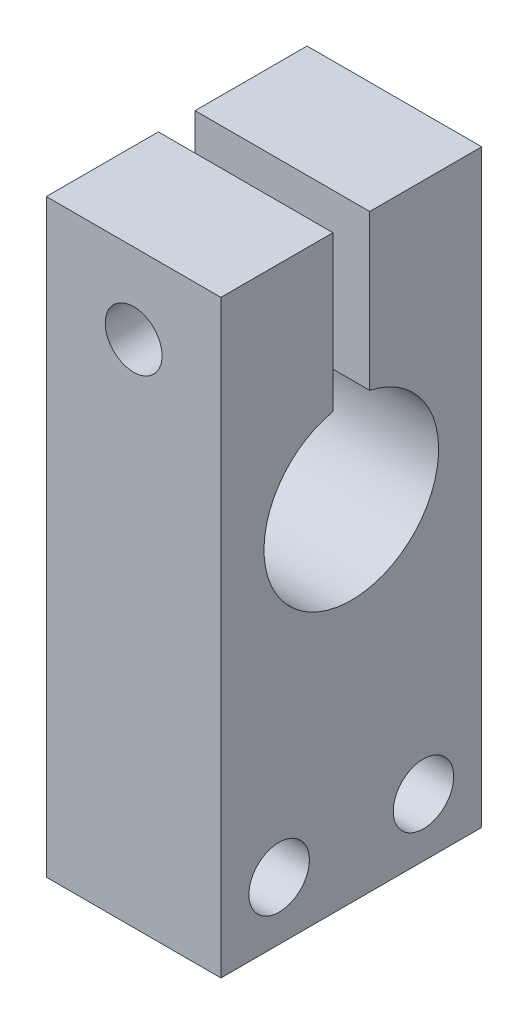
from build123d import *

# Parameters (mm, degrees)
SKETCH1_W                                          = 31.75
SKETCH1_H                                          = 32.1564
BOSS_EXTRUDE1_DEPTH                                = 9.525
SKETCH2_W                                          = 8.763
SKETCH2_H                                          = 32.1564
CUT_EXTRUDE1_DEPTH                                 = 27.563955842
CUT_EXTRUDE2_DEPTH                                 = 27.563955842
SKETCH4_W                                          = 8.763
SKETCH4_H                                          = 32.16
CUT_EXTRUDE3_DEPTH                                 = 27.563955842
SKETCH5_W                                          = 9.525
SKETCH5_H                                          = 4.7625
SKETCH6_W                                          = 1.3208
SKETCH6_H                                          = 6.1087
CBORE_FOR_M2_5_HEX_HEAD_MACHINE_SCREW1_D           = 3.1
CBORE_FOR_M2_5_HEX_HEAD_MACHINE_SCREW1_CBORE_D     = 7.28
CBORE_FOR_M2_5_HEX_HEAD_MACHINE_SCREW1_CBORE_DEPTH = 2.1
M4X0_7_TAPPED_HOLE1_D                              = 3.3


with BuildPart() as part:
    # Sketch1 → Boss-Extrude1 (new body)
    with BuildSketch(Plane(origin=(4.7625, 0, 0), x_dir=(0, 0, -1), z_dir=(1, 0, 0))):
        with Locations((0, -2.9718)):
            Rectangle(SKETCH1_W, SKETCH1_H)
    extrude(amount=-BOSS_EXTRUDE1_DEPTH)

    # Sketch2 → Cut-Extrude1 (cut, through all)
    with BuildSketch(Plane.ZY.offset(4.7625)):
        with Locations((-11.4935, -2.9718)):
            Rectangle(SKETCH2_W, SKETCH2_H)
    extrude(amount=-CUT_EXTRUDE1_DEPTH, mode=Mode.SUBTRACT)

    # Sketch3 → Cut-Extrude2 (cut, through all)
    with BuildSketch(Plane.ZY.offset(4.7625)):
        with BuildLine():
            Line((1.0033, 13.1064), (-1.0033, 13.1064))
            Line((-1.0033, 13.1064), (-1.0033, 4.655619761))
            ThreePointArc((-1.0033, 4.655619761), (0, 4.7625), (1.0033, 4.655619761))
            Line((1.0033, 4.655619761), (1.0033, 13.1064))
        make_face()
    extrude(amount=-CUT_EXTRUDE2_DEPTH, mode=Mode.SUBTRACT)

    # Sketch4 → Cut-Extrude3 (cut, through all)
    with BuildSketch(Plane.ZY.offset(4.7625)):
        with Locations((11.4935, -2.9736)):
            Rectangle(SKETCH4_W, SKETCH4_H)
    extrude(amount=-CUT_EXTRUDE3_DEPTH, mode=Mode.SUBTRACT)

    # Sketch5 → Cut-Revolve1 (revolve, cut)
    with BuildSketch(Plane.XY):
        with Locations((0, 2.38125)):
            Rectangle(SKETCH5_W, SKETCH5_H)
    revolve(axis=Axis((-4.7625, 0, 0), (1, 0, 0)), mode=Mode.SUBTRACT)

    # Sketch6 → Hole1 (revolve, cut)
    with BuildSketch(Plane(origin=(0, 8.7376, 1.0033), x_dir=(0, 1, 0), z_dir=(1, 0, 0))):
        with Locations((0.6604, 3.05435)):
            Rectangle(SKETCH6_W, SKETCH6_H)
    revolve(axis=Axis((0, 8.7376, 111.0033), (0, 0, -1)), mode=Mode.SUBTRACT)

    # CBORE for M2.5 Hex Head Machine Screw1 (through all)
    with Locations(Plane(origin=(0, 0, -7.112), x_dir=(-1, 0, 0), z_dir=(0, 0, -1))):
        with Locations((0, 8.7376)):
            CounterBoreHole(CBORE_FOR_M2_5_HEX_HEAD_MACHINE_SCREW1_D / 2, CBORE_FOR_M2_5_HEX_HEAD_MACHINE_SCREW1_CBORE_D / 2, CBORE_FOR_M2_5_HEX_HEAD_MACHINE_SCREW1_CBORE_DEPTH)

    # M4x0.7 Tapped Hole1 (through all)
    with Locations(Plane(origin=(4.7625, -17.4625, 0), x_dir=(0, 1, 0), z_dir=(1, 0, 0))):
        with Locations((1.5875, -3.937), (1.5875, 3.937)):
            Hole(M4X0_7_TAPPED_HOLE1_D / 2)


solid = part.part
